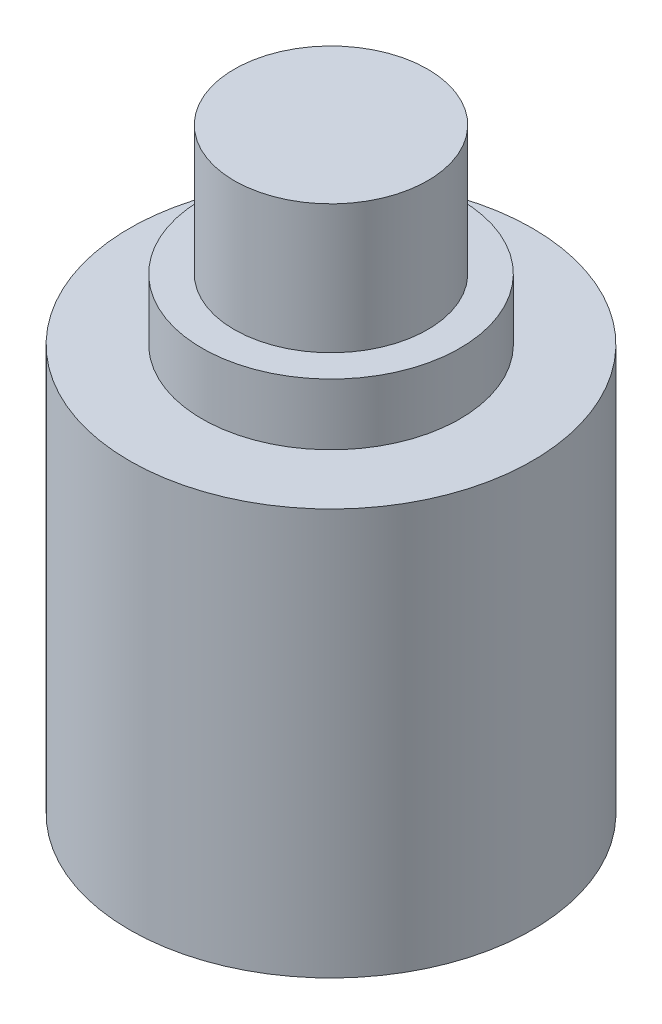
from build123d import *

# Parameters (mm, degrees)
SKETCH_1_R      = 12.5
EXTRUDE_1_DEPTH = 25.2
SKETCH_2_R      = 8
EXTRUDE_2_DEPTH = 3.8
SKETCH_3_R      = 6
EXTRUDE_3_DEPTH = 8


with BuildPart() as part:
    # 草图1 → 凸台-拉伸1 (new body)
    with BuildSketch(Plane(origin=(0, 0, 0), x_dir=(1, 0, 0), z_dir=(0, 1, 0))):
        with Locations(Location((0, 0, 0), (0, 0, 270))):
            Circle(SKETCH_1_R)
    extrude(amount=EXTRUDE_1_DEPTH)

    # 草图2 → 凸台-拉伸2 (add)
    with BuildSketch(Plane(origin=(0, 25.2, 0), x_dir=(1, 0, 0), z_dir=(0, 1, 0))):
        with Locations(Location((0, 0, 0), (0, 0, 90))):
            Circle(SKETCH_2_R)
    extrude(amount=EXTRUDE_2_DEPTH)

    # 草图3 → 凸台-拉伸3 (add)
    with BuildSketch(Plane(origin=(0, 29, 0), x_dir=(1, 0, 0), z_dir=(0, 1, 0))):
        with Locations(Location((0, 0, 0), (0, 0, 270))):
            Circle(SKETCH_3_R)
    extrude(amount=EXTRUDE_3_DEPTH)


solid = part.part
